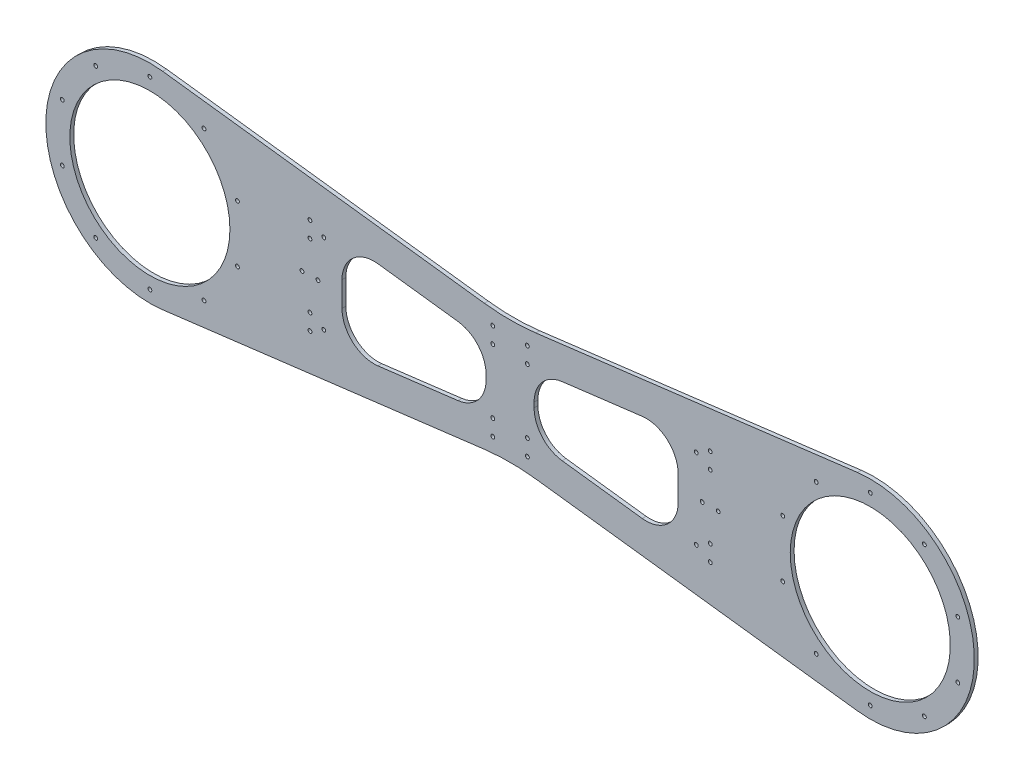
from build123d import *

# Parameters (mm, degrees)
SKETCH1_R           = 250
SKETCH1_R_2         = 6
BOSS_EXTRUDE1_DEPTH = 12
FILLET1_R           = 650
FILLET2_R           = 100


with BuildPart() as part:
    # Sketch1 → Boss-Extrude1 (new body)
    with BuildSketch(Plane.XY):
        with BuildLine():
            Line((-1084.863121667, 322.512063337), (0, 187.5))
            Line((0, 187.5), (0, -187.5))
            Line((0, -187.5), (-1084.863121667, -322.512063337))
            ThreePointArc((-1084.863121667, -322.512063337), (-1450, 0), (-1084.863121667, 322.512063337))
        make_face()
        with Locations((-1125, 0)):
            Circle(SKETCH1_R, mode=Mode.SUBTRACT)
        with Locations((-1125, 287.5)):
            Circle(SKETCH1_R_2, mode=Mode.SUBTRACT)
        with Locations((-956.011739966, 232.592385883)):
            Circle(SKETCH1_R_2, mode=Mode.SUBTRACT)
        with Locations((-851.571251565, 88.842385883)):
            Circle(SKETCH1_R_2, mode=Mode.SUBTRACT)
        with Locations((-851.571251565, -88.842385883)):
            Circle(SKETCH1_R_2, mode=Mode.SUBTRACT)
        with Locations((-956.011739966, -232.592385883)):
            Circle(SKETCH1_R_2, mode=Mode.SUBTRACT)
        with Locations((-1125, -287.5)):
            Circle(SKETCH1_R_2, mode=Mode.SUBTRACT)
        with Locations((-1293.988260034, -232.592385883)):
            Circle(SKETCH1_R_2, mode=Mode.SUBTRACT)
        with Locations((-1398.428748435, -88.842385883)):
            Circle(SKETCH1_R_2, mode=Mode.SUBTRACT)
        with Locations((-1398.428748435, 88.842385883)):
            Circle(SKETCH1_R_2, mode=Mode.SUBTRACT)
        with Locations((-1293.988260034, 232.592385883)):
            Circle(SKETCH1_R_2, mode=Mode.SUBTRACT)
        with Locations((-625, 150)):
            Circle(SKETCH1_R_2, mode=Mode.SUBTRACT)
        with Locations((-625, 100)):
            Circle(SKETCH1_R_2, mode=Mode.SUBTRACT)
        with Locations((-581.698729811, 125)):
            Circle(SKETCH1_R_2, mode=Mode.SUBTRACT)
        with Locations(Location((-625, -150, 0), (0, 0, 180))):
            Circle(SKETCH1_R_2, mode=Mode.SUBTRACT)
        with Locations(Location((-581.698729811, -125, 0), (0, 0, 180))):
            Circle(SKETCH1_R_2, mode=Mode.SUBTRACT)
        with Locations(Location((-625, -100, 0), (0, 0, 180))):
            Circle(SKETCH1_R_2, mode=Mode.SUBTRACT)
        with Locations((-600, 0)):
            Circle(SKETCH1_R_2, mode=Mode.SUBTRACT)
        with Locations((-650, 0)):
            Circle(SKETCH1_R_2, mode=Mode.SUBTRACT)
        with Locations((-54, 150)):
            Circle(SKETCH1_R_2, mode=Mode.SUBTRACT)
        with Locations((-54, 100)):
            Circle(SKETCH1_R_2, mode=Mode.SUBTRACT)
        with Locations(Location((-54, -150, 0), (0, 0, 180))):
            Circle(SKETCH1_R_2, mode=Mode.SUBTRACT)
        with Locations(Location((-54, -100, 0), (0, 0, 180))):
            Circle(SKETCH1_R_2, mode=Mode.SUBTRACT)
        Polygon((-75, 96.062384241), (-75, -96.062384241), (-525, -152.065235926), (-525, 152.065235926), align=None, mode=Mode.SUBTRACT)
    boss_extrude1 = extrude(amount=BOSS_EXTRUDE1_DEPTH)

    # Mirror1: Boss-Extrude1 across plane
    add(boss_extrude1.mirror(Plane(origin=(0, -187.5, 12), x_dir=(0, 0, 1), z_dir=(-1, 0, 0))))

    # Fillet1
    fillet1_edges = [part.edges().sort_by_distance(p)[0] for p in [
        (0, 187.5, 6),
        (0, -187.5, 6),
    ]]
    fillet(fillet1_edges, radius=FILLET1_R)

    # Fillet2
    fillet2_edges = [part.edges().sort_by_distance(p)[0] for p in [
        (75, 96.062384241, 6),
        (75, -96.062384241, 6),
        (525, -152.065235926, 6),
        (525, 152.065235926, 6),
        (-75, 96.062384241, 6),
        (-525, 152.065235926, 6),
        (-525, -152.065235926, 6),
        (-75, -96.062384241, 6),
    ]]
    fillet(fillet2_edges, radius=FILLET2_R)


solid = part.part
